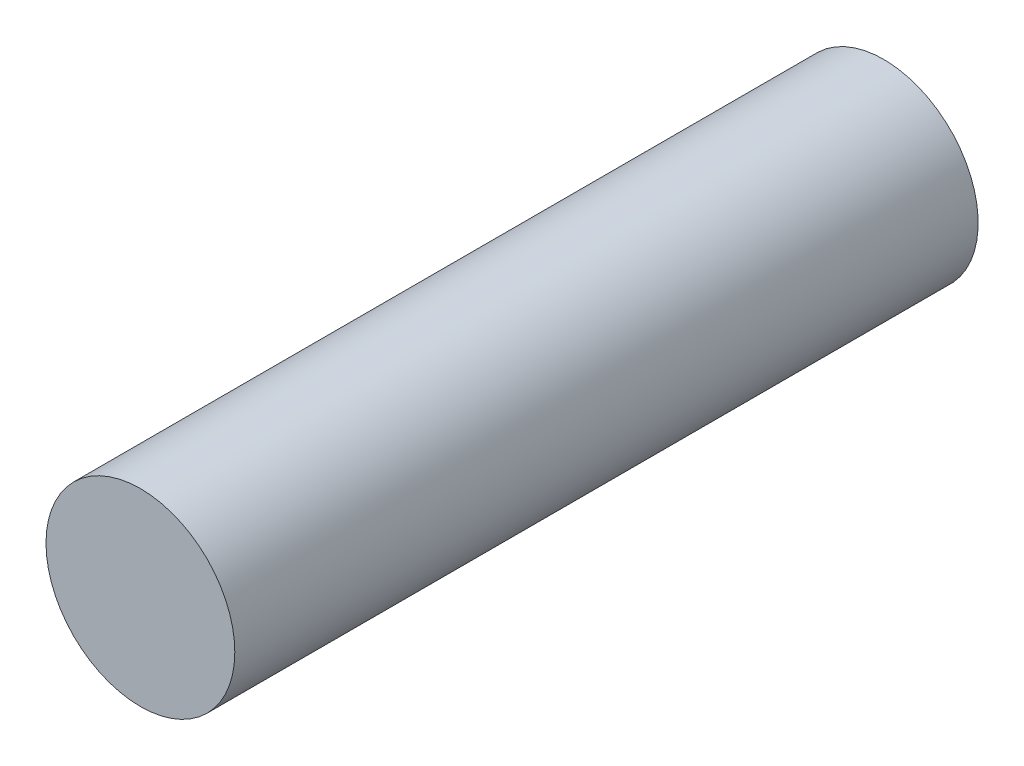
from build123d import *

# Parameters (mm, degrees)
SKETCH1_R           = 12.7
BOSS_EXTRUDE1_DEPTH = 75
BOSS_EXTRUDE2_START = 25
SKETCH2_R           = 12.7
SKETCH2_R_2         = 9
BOSS_EXTRUDE2_DEPTH = 25


with BuildPart() as part:
    # Sketch1 → Boss-Extrude1 (new body)
    with BuildSketch(Plane.XY):
        Circle(SKETCH1_R)
    extrude(amount=BOSS_EXTRUDE1_DEPTH)

    # Sketch2 → Boss-Extrude2 (add)
    with BuildSketch(Plane(origin=(0, 0, 0), x_dir=(-1, 0, 0), z_dir=(0, 0, -1)).offset(BOSS_EXTRUDE2_START)):
        Circle(SKETCH2_R)
        Circle(SKETCH2_R_2, mode=Mode.SUBTRACT)
    extrude(amount=-BOSS_EXTRUDE2_DEPTH)


solid = part.part
